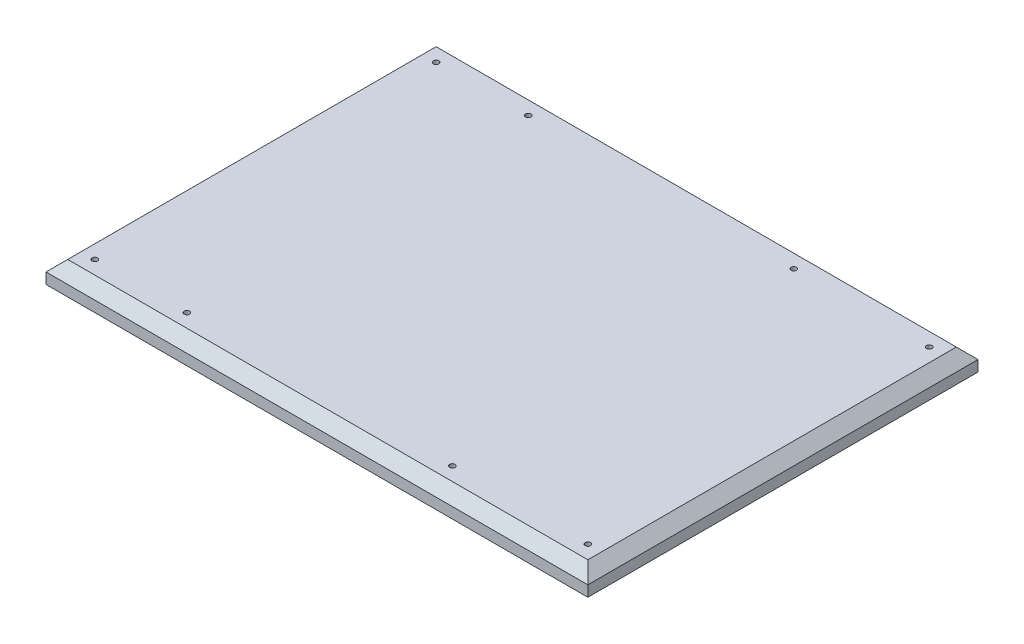
from build123d import *

# Parameters (mm, degrees)
SKIZZE1_W                       = 500
SKIZZE1_H                       = 360
AUFSATZ_LINEAR_AUSTRAGEN1_DEPTH = 20
FASE1_SIZE                      = 10
SKIZZE2_R                       = 2.5
SCHNITT_LINEAR_AUSTRAGEN1_DEPTH = 309.706980809


with BuildPart() as part:
    # Skizze1 → Aufsatz-Linear austragen1 (new body)
    with BuildSketch(Plane(origin=(0, 0, 0), x_dir=(1, 0, 0), z_dir=(0, 1, 0))):
        Rectangle(SKIZZE1_W, SKIZZE1_H)
    extrude(amount=AUFSATZ_LINEAR_AUSTRAGEN1_DEPTH)

    # Fase1
    fase1_edges = [part.edges().sort_by_distance(p)[0] for p in [
        (-250, 20, 0),
        (0, 20, 180),
        (250, 20, 0),
        (0, 20, -180),
    ]]
    chamfer(fase1_edges, length=FASE1_SIZE)

    # Skizze2 → Schnitt-Linear austragen1 (cut, through all)
    with BuildSketch(Plane(origin=(0, 20, 0), x_dir=(1, 0, 0), z_dir=(0, 1, 0))):
        with Locations(Location((-227.5, -157.5, 0), (0, 0, 270))):
            Circle(SKIZZE2_R)
        with Locations(Location((-142.5, -157.5, 0), (0, 0, 270))):
            Circle(SKIZZE2_R)
        with Locations(Location((102.5, -157.5, 0), (0, 0, 270))):
            Circle(SKIZZE2_R)
        with Locations(Location((227.5, -157.5, 0), (0, 0, 270))):
            Circle(SKIZZE2_R)
        with Locations(Location((-227.5, 157.5, 0), (0, 0, 270))):
            Circle(SKIZZE2_R)
        with Locations(Location((-142.5, 157.5, 0), (0, 0, 270))):
            Circle(SKIZZE2_R)
        with Locations(Location((102.5, 157.5, 0), (0, 0, 270))):
            Circle(SKIZZE2_R)
        with Locations(Location((227.5, 157.5, 0), (0, 0, 270))):
            Circle(SKIZZE2_R)
    extrude(amount=-SCHNITT_LINEAR_AUSTRAGEN1_DEPTH, mode=Mode.SUBTRACT)


solid = part.part
